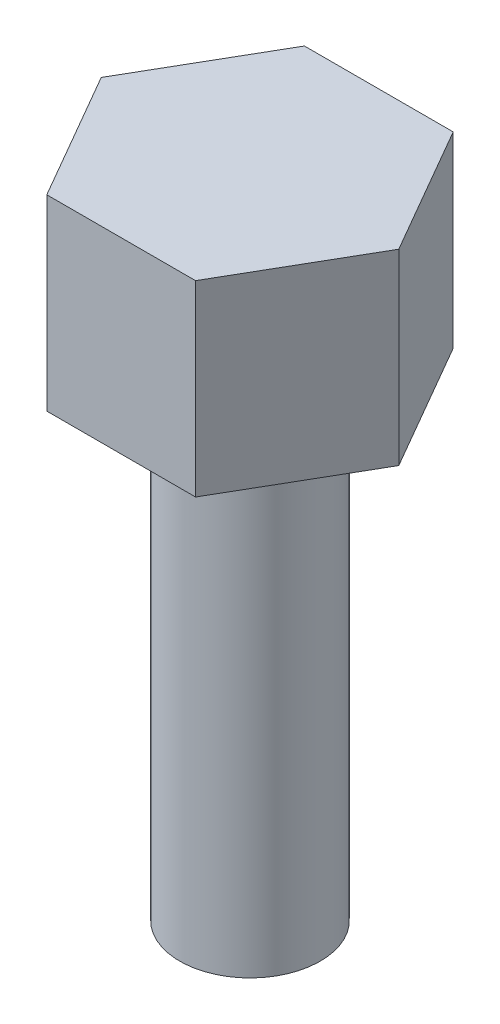
from build123d import *

# Parameters (mm, degrees)
BOSS_EXTRUDE1_DEPTH = 4
SKETCH2_R           = 1.5
BOSS_EXTRUDE2_DEPTH = 10


with BuildPart() as part:
    # Sketch1 → Boss-Extrude1 (new body)
    with BuildSketch(Plane(origin=(0, 0, 0), x_dir=(1, 0, 0), z_dir=(0, 1, 0))):
        Polygon((3.175426481, 0), (1.58771324, 2.75), (-1.58771324, 2.75), (-3.175426481, 0), (-1.58771324, -2.75), (1.58771324, -2.75), align=None)
    extrude(amount=BOSS_EXTRUDE1_DEPTH)

    # Sketch2 → Boss-Extrude2 (add)
    with BuildSketch(Plane.XZ):
        with Locations(Location((0, 0, 0), (0, 0, 270))):
            Circle(SKETCH2_R)
    extrude(amount=BOSS_EXTRUDE2_DEPTH)


solid = part.part
